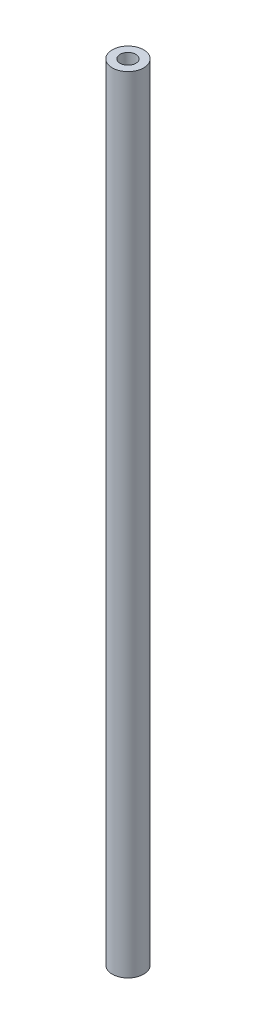
from build123d import *

# Parameters (mm, degrees)
SKETCH_1_R          = 3
EXTRUDE_1_DEPTH     = 150
SKETCH_2_R          = 1.5
CUT_EXTRUDE_1_DEPTH = 10
CUT_EXTRUDE_START   = -10
SKETCH_3_R          = 1.5
CUT_EXTRUDE_2_DEPTH = 10


with BuildPart() as part:
    # 草图1 → 凸台-拉伸1 (new body)
    with BuildSketch(Plane(origin=(0, 0, 0), x_dir=(1, 0, 0), z_dir=(0, 1, 0))):
        with Locations(Location((0, 0, 0), (0, 0, 270))):
            Circle(SKETCH_1_R)
    extrude(amount=EXTRUDE_1_DEPTH)

    # 草图2 → 切除-拉伸1 (cut)
    with BuildSketch(Plane(origin=(0, 150, 0), x_dir=(1, 0, 0), z_dir=(0, 1, 0))):
        with Locations(Location((0, 0, 0), (0, 0, 270))):
            Circle(SKETCH_2_R)
    extrude(amount=-CUT_EXTRUDE_1_DEPTH, mode=Mode.SUBTRACT)

    # 草图3 → 切除-拉伸2 (cut)
    with BuildSketch(Plane.XZ.offset(CUT_EXTRUDE_START)):
        with Locations(Location((0, 0, 0), (0, 0, 90))):
            Circle(SKETCH_3_R)
    extrude(amount=CUT_EXTRUDE_2_DEPTH, mode=Mode.SUBTRACT)


solid = part.part
